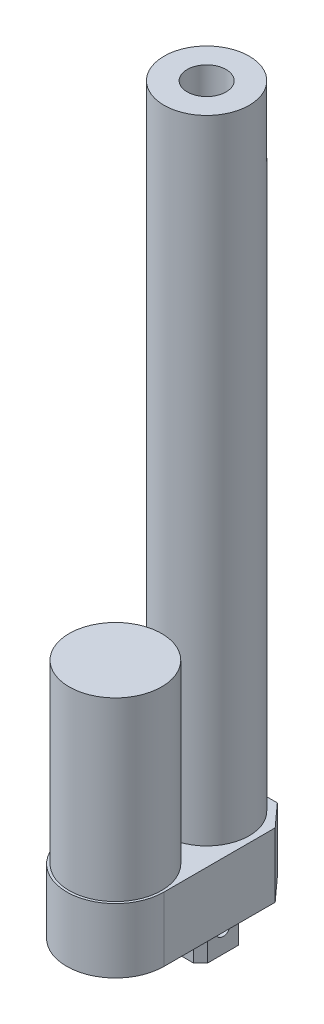
from build123d import *

# Parameters (mm, degrees)
BOSS_EXTRUDE1_DEPTH = 26.5
SKETCH2_R           = 19
BOSS_EXTRUDE2_DEPTH = 72.5
BOSS_EXTRUDE3_DEPTH = 18.5
SKETCH4_R           = 3
CUT_EXTRUDE1_DEPTH  = 18.5
SKETCH5_R           = 17.5
BOSS_EXTRUDE4_DEPTH = 260
SKETCH6_R           = 8
CUT_EXTRUDE2_DEPTH  = 200


with BuildPart() as part:
    # Sketch1 → Boss-Extrude1 (new body)
    with BuildSketch(Plane(origin=(0, 0, 0), x_dir=(1, 0, 0), z_dir=(0, 1, 0))):
        with BuildLine():
            Line((20, -17.5), (20, 28.170367296))
            Line((20, 28.170367296), (11.543200417, 37.5))
            Line((11.543200417, 37.5), (-11.543200417, 37.5))
            Line((-11.543200417, 37.5), (-20, 28.170367296))
            Line((-20, 28.170367296), (-20, -17.5))
            ThreePointArc((-20, -17.5), (0, -37.5), (20, -17.5))
        make_face()
    extrude(amount=BOSS_EXTRUDE1_DEPTH)

    # Sketch2 → Boss-Extrude2 (add)
    with BuildSketch(Plane(origin=(0, 26.5, 0), x_dir=(1, 0, 0), z_dir=(0, 1, 0))):
        with Locations(Location((0, -17.5, 0), (0, 0, 270))):
            Circle(SKETCH2_R)
    extrude(amount=BOSS_EXTRUDE2_DEPTH)

    # Sketch3 → Boss-Extrude3 (add)
    with BuildSketch(Plane.XZ):
        Polygon((6.370308286, -26.75), (-6.370308286, -26.75), (-9.25, -23.870308286), (-9.25, -11.129691714), (-6.370308286, -8.25), (6.370308286, -8.25), (9.25, -11.129691714), (9.25, -23.870308286), align=None)
    extrude(amount=BOSS_EXTRUDE3_DEPTH)

    # Sketch4 → Cut-Extrude1 (cut)
    with BuildSketch(Plane(origin=(9.25, 0, 0), x_dir=(0, 0, -1), z_dir=(1, 0, 0))):
        with Locations((17.5, -9.25)):
            Circle(SKETCH4_R)
    extrude(amount=-CUT_EXTRUDE1_DEPTH, mode=Mode.SUBTRACT)

    # Sketch5 → Boss-Extrude4 (add)
    with BuildSketch(Plane(origin=(0, 26.5, 0), x_dir=(1, 0, 0), z_dir=(0, 1, 0))):
        with Locations(Location((0, 20, 0), (0, 0, 90))):
            Circle(SKETCH5_R)
    extrude(amount=BOSS_EXTRUDE4_DEPTH)

    # Sketch6 → Cut-Extrude2 (cut)
    with BuildSketch(Plane(origin=(0, 286.5, 0), x_dir=(1, 0, 0), z_dir=(0, 1, 0))):
        with Locations(Location((0, 20, 0), (0, 0, 270))):
            Circle(SKETCH6_R)
    extrude(amount=-CUT_EXTRUDE2_DEPTH, mode=Mode.SUBTRACT)


solid = part.part
